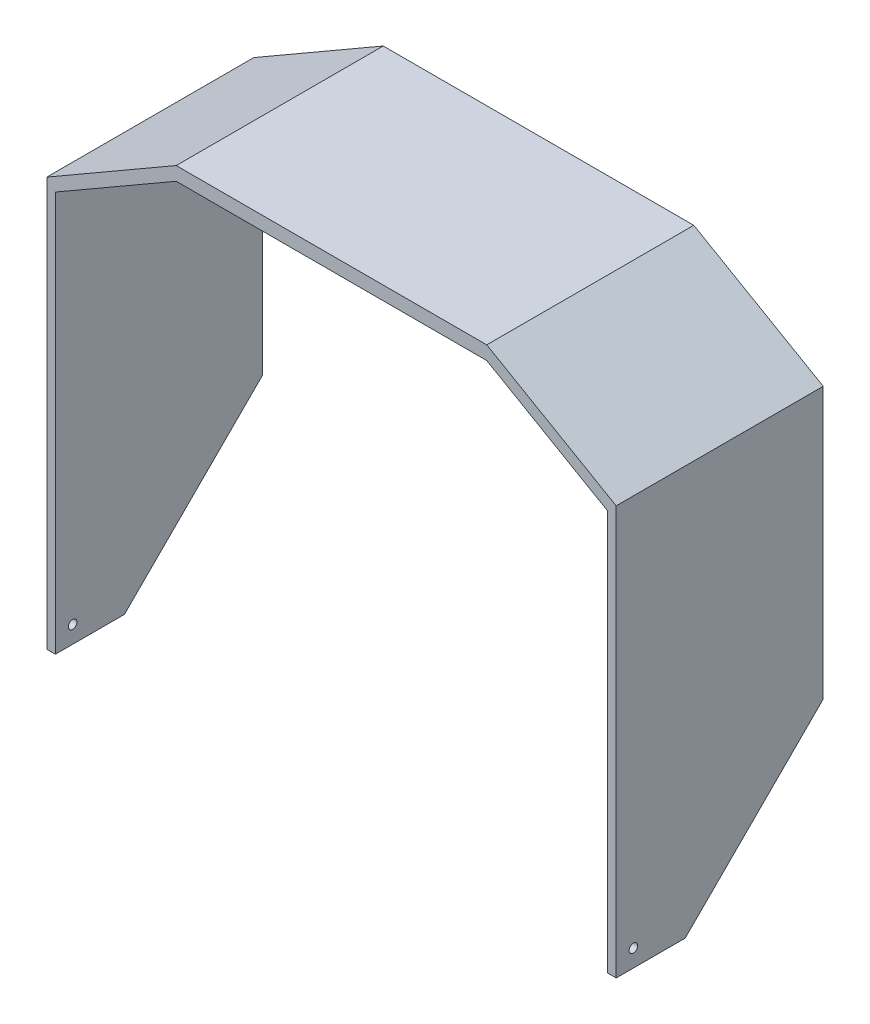
from build123d import *

# Parameters (mm, degrees)
BOSS_EXTRUDE2_DEPTH     = 120
CUT_EXTRUDE2_DEPTH      = 421.861022191
CUT_EXTRUDE2_DEPTH_BACK = 421.861022191
SKETCH5_R               = 2.5


with BuildPart() as part:
    # Sketch3 → Boss-Extrude2 (new body)
    with BuildSketch(Plane.XY):
        Polygon((-5, 5), (-5, -232), (0, -232), (0, 0), (70, 40.414518843), (250, 40.414518843), (320, 0), (320, -232), (325, -232), (325, 5), (250, 48.301270189), (70, 48.301270189), align=None)
    extrude(amount=BOSS_EXTRUDE2_DEPTH)

    # Sketch5 → Cut-Extrude2 (cut, two sides: drawn at the far end of the back side and taken through both)
    with BuildSketch(Plane(origin=(325, 0, 0), x_dir=(0, 0, -1), z_dir=(1, 0, 0)).offset(-CUT_EXTRUDE2_DEPTH_BACK)):
        with Locations((-110, -222)):
            Circle(SKETCH5_R)
        Polygon((-80, -232), (0, -152), (0, -232), align=None)
    extrude(amount=CUT_EXTRUDE2_DEPTH + CUT_EXTRUDE2_DEPTH_BACK, mode=Mode.SUBTRACT)


solid = part.part
